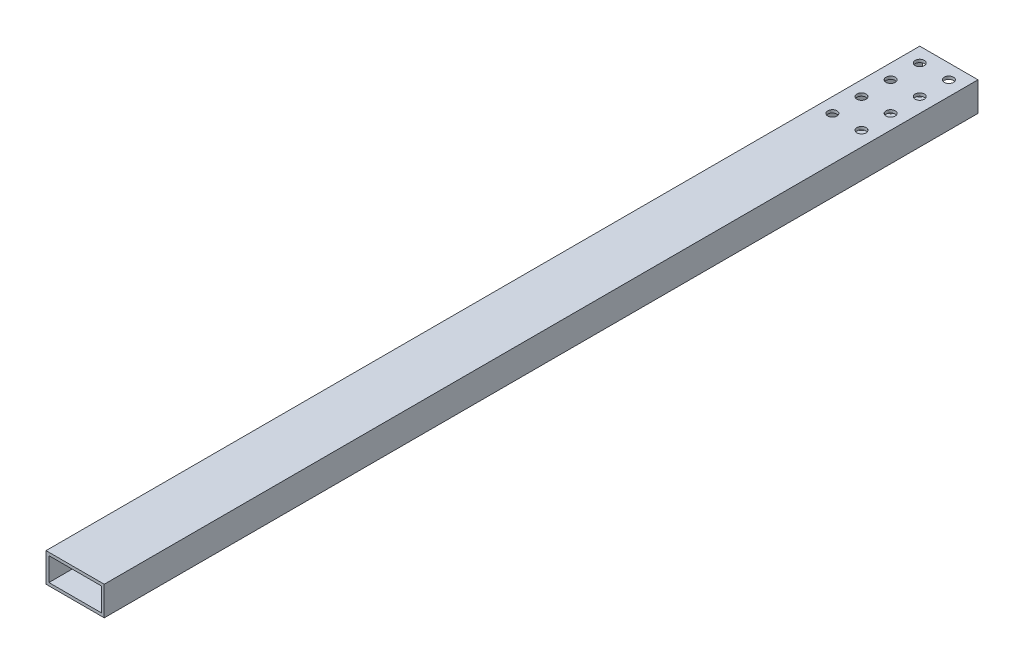
from build123d import *

# Parameters (mm, degrees)
SKETCH_1_W          = 20
SKETCH_1_H          = 10
SKETCH_1_W_2        = 18
SKETCH_1_H_2        = 8
EXTRUDE_1_DEPTH     = 300
SKETCH_2_R          = 1.575
CUT_EXTRUDE_1_DEPTH = 301.83217913


with BuildPart() as part:
    # 草图1 → 拉伸-薄壁1 (new body)
    with BuildSketch(Plane.XY):
        with Locations((10, -5)):
            Rectangle(SKETCH_1_W, SKETCH_1_H)
        with Locations((10, -5)):
            Rectangle(SKETCH_1_W_2, SKETCH_1_H_2, mode=Mode.SUBTRACT)
    extrude(amount=EXTRUDE_1_DEPTH)

    # 草图2 → 切除-拉伸1 (cut, through all)
    with BuildSketch(Plane(origin=(0, 0, 0), x_dir=(1, 0, 0), z_dir=(0, 1, 0))):
        with Locations(Location((15, -5, 0), (0, 0, 270))):
            Circle(SKETCH_2_R)
        with Locations(Location((5, -5, 0), (0, 0, 90))):
            Circle(SKETCH_2_R)
        with Locations(Location((5, -15, 0), (0, 0, 270))):
            Circle(SKETCH_2_R)
        with Locations(Location((15, -15, 0), (0, 0, 90))):
            Circle(SKETCH_2_R)
        with Locations(Location((15, -25, 0), (0, 0, 270))):
            Circle(SKETCH_2_R)
        with Locations(Location((5, -25, 0), (0, 0, 90))):
            Circle(SKETCH_2_R)
        with Locations(Location((5, -35, 0), (0, 0, 270))):
            Circle(SKETCH_2_R)
        with Locations(Location((15, -35, 0), (0, 0, 90))):
            Circle(SKETCH_2_R)
    extrude(amount=-CUT_EXTRUDE_1_DEPTH, mode=Mode.SUBTRACT)


solid = part.part
